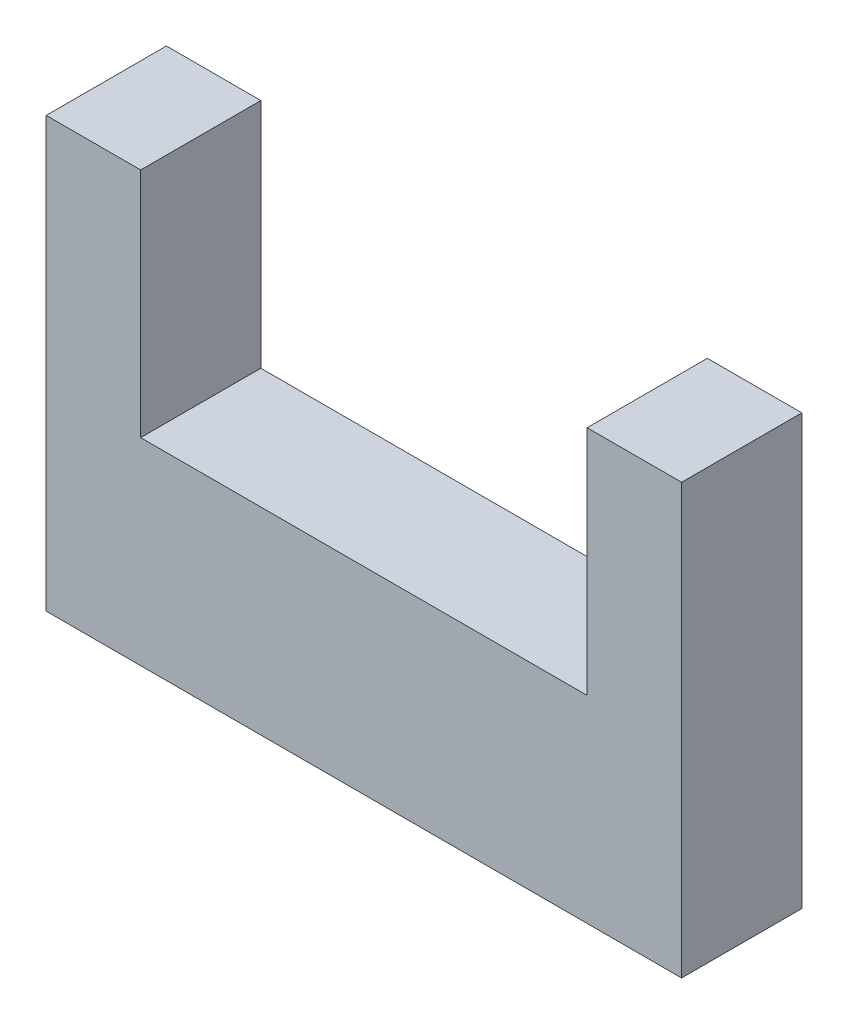
from build123d import *

# Parameters (mm, degrees)
BOSS_EXTRUDE1_DEPTH = 7


with BuildPart() as part:
    # Sketch1 → Boss-Extrude1 (new body)
    with BuildSketch(Plane.XY):
        Polygon((14.5, 67.260869565), (14.5, 80.760869565), (20, 80.760869565), (20, 55.760869565), (-17, 55.760869565), (-17, 80.760869565), (-11.5, 80.760869565), (-11.5, 67.260869565), align=None)
    extrude(amount=-BOSS_EXTRUDE1_DEPTH)


solid = part.part
